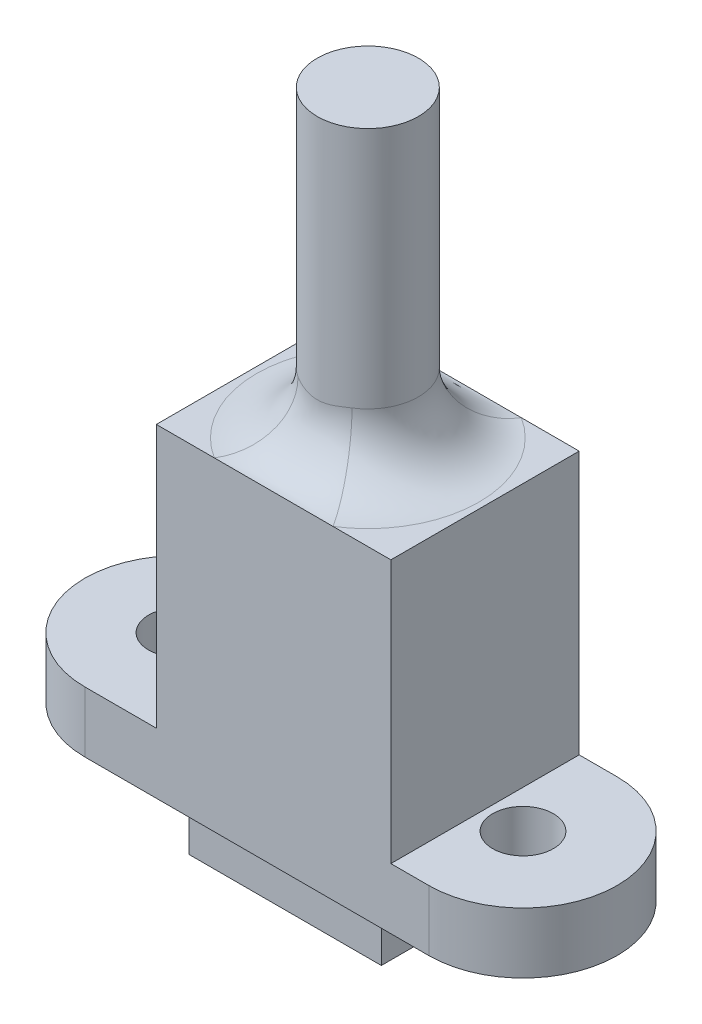
from build123d import *

# Parameters (mm, degrees)
EXTRUDE_1_DEPTH     = 3
SKETCH_1_3_W        = 9.5
SKETCH_1_3_H        = 6.5
EXTRUDE_2_DEPTH     = 3
SKETCH_1_4_R        = 1.5
CUT_EXTRUDE_1_DEPTH = 3
CUT_EXTRUDE_2_DEPTH = 3
SKETCH_3_W          = 11.590372196
SKETCH_3_H          = 9.306034482
EXTRUDE_3_DEPTH     = 13
SKETCH_4_R          = 2.5
EXTRUDE_4_DEPTH     = 15
FILLET_1_R          = 3


with BuildPart() as part:
    # 草图1 → 凸台-拉伸1 (new body)
    with BuildSketch(Plane(origin=(0, 0, 0), x_dir=(1, 0, 0), z_dir=(0, 1, 0))):
        with BuildLine():
            Line((-9.33144513, 4.653017241), (7.66855487, 4.653017241))
            ThreePointArc((7.66855487, 4.653017241), (12.321572111, 0), (7.66855487, -4.653017241))
            Line((7.66855487, -4.653017241), (-9.33144513, -4.653017241))
            ThreePointArc((-9.33144513, -4.653017241), (-13.984462372, 0), (-9.33144513, 4.653017241))
        make_face()
    extrude(amount=EXTRUDE_1_DEPTH)

    # 草图1<3> → 凸台-拉伸2 (add)
    with BuildSketch(Plane(origin=(0, 0, 0), x_dir=(1, 0, 0), z_dir=(0, 1, 0))):
        with Locations((-0.83144513, 0)):
            Rectangle(SKETCH_1_3_W, SKETCH_1_3_H)
    extrude(amount=-EXTRUDE_2_DEPTH)

    # 草图1<4> → 切除-拉伸1 (cut)
    with BuildSketch(Plane(origin=(0, 0, 0), x_dir=(1, 0, 0), z_dir=(0, 1, 0))):
        with Locations((-9.33144513, 0)):
            Circle(SKETCH_1_4_R)
        with Locations((7.66855487, 0)):
            Circle(SKETCH_1_4_R)
    extrude(amount=CUT_EXTRUDE_1_DEPTH, mode=Mode.SUBTRACT)

    # 草图2 → 切除-拉伸2 (cut)
    with BuildSketch(Plane.XZ.offset(3)):
        Polygon((-4.58144513, 1.75), (2.91855487, 1.75), (2.301410437, -1.75), (-3.964300698, -1.75), align=None)
    extrude(amount=-CUT_EXTRUDE_2_DEPTH, mode=Mode.SUBTRACT)

    # 草图3 → 凸台-拉伸3 (add)
    with BuildSketch(Plane(origin=(0, 3, 0), x_dir=(1, 0, 0), z_dir=(0, 1, 0))):
        with Locations((-0.00308465, 0)):
            Rectangle(SKETCH_3_W, SKETCH_3_H)
    extrude(amount=EXTRUDE_3_DEPTH)

    # 草图4 → 凸台-拉伸4 (add)
    with BuildSketch(Plane(origin=(0, 16, 0), x_dir=(1, 0, 0), z_dir=(0, 1, 0))):
        Circle(SKETCH_4_R)
    extrude(amount=EXTRUDE_4_DEPTH)

    # 圆角1
    fillet_1_edges = [part.edges().sort_by_distance(p)[0] for p in [
        (-2.5, 16, 0),
    ]]
    fillet(fillet_1_edges, radius=FILLET_1_R)


solid = part.part
